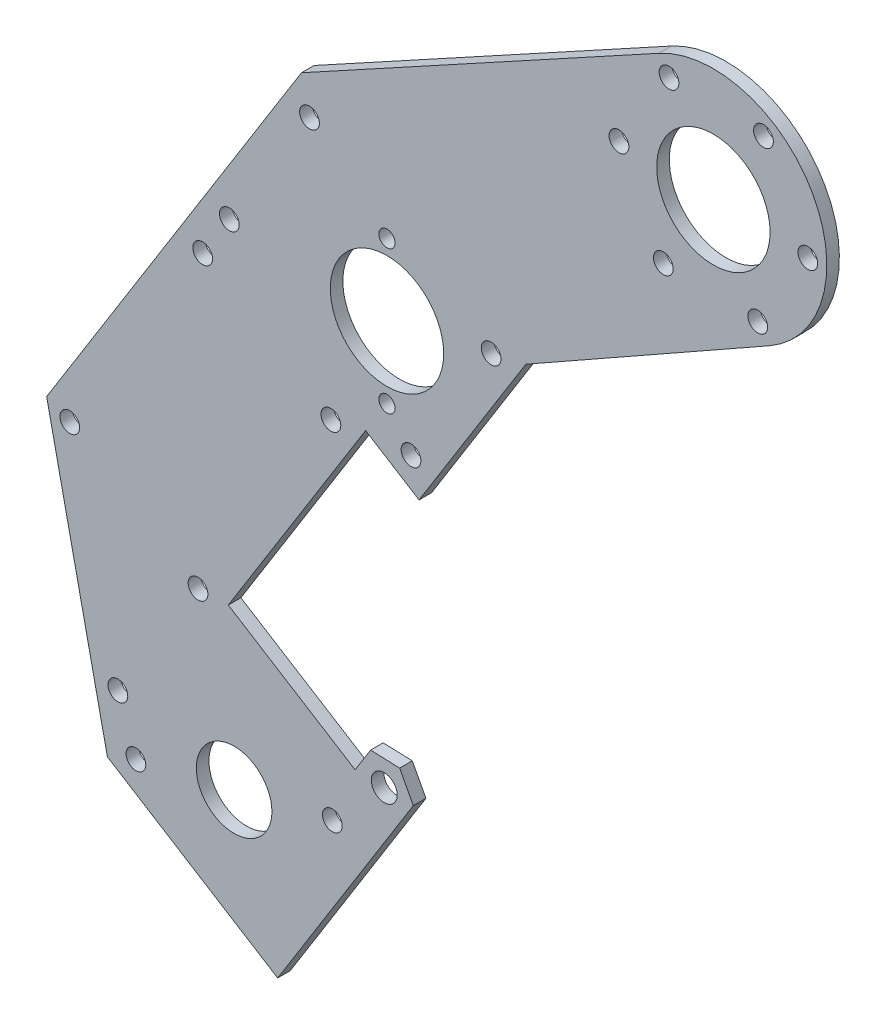
from build123d import *

# Parameters (mm, degrees)
SKETCH1_R                   = 14.2875
SKETCH1_R_2                 = 9.525
BOSS_EXTRUDE1_DEPTH         = 3.175
F_10_CLEARANCE_HOLE2_D      = 4.9784
F_10_CLEARANCE_HOLE3_D      = 4.9784
F_1_4_CLEARANCE_HOLE1_D     = 6.5278
F_20_0_161_DIAMETER_HOLE1_D = 4.0894


with BuildPart() as part:
    # Sketch1 → Boss-Extrude1 (new body)
    with BuildSketch(Plane.XY.offset(-14.194599474)):
        with BuildLine():
            Line((-11.403602879, 461.040918113), (18.881283072, 509.506866808))
            Line((18.881283072, 509.506866808), (22.784668372, 515.753589084))
            Line((22.784668372, 515.753589084), (19.342339301, 522.227668471))
            Line((19.342339301, 522.227668471), (12.014457551, 522.48356374))
            Line((12.014457551, 522.48356374), (8.11107225, 516.236841464))
            Line((8.11107225, 516.236841464), (-23.846467356, 536.206128526))
            Line((-23.846467356, 536.206128526), (10.759214603, 591.586796266))
            Line((10.759214603, 591.586796266), (24.22197813, 583.174327946))
            Line((24.22197813, 583.174327946), (51.141876753, 626.255171231))
            Line((51.141876753, 626.255171231), (112.462044501, 660.93728694))
            ThreePointArc((112.462044501, 660.93728694), (123.365099157, 699.702028841), (84.677956887, 710.877306848))
            Line((84.677956887, 710.877306848), (-5.401730059, 661.587538174))
            Line((-5.401730059, 661.587538174), (-69.615486106, 558.824047132))
            Line((-69.615486106, 558.824047132), (-54.307899735, 487.850498283))
            Line((-54.307899735, 487.850498283), (-11.403602879, 461.040918113))
        make_face()
        with Locations((16.14150623, 618.174698631)):
            Circle(SKETCH1_R, mode=Mode.SUBTRACT)
        with Locations((-22.373657227, 496.622766323)):
            Circle(SKETCH1_R_2, mode=Mode.SUBTRACT)
        with Locations((98.394472266, 685.809641802)):
            Circle(SKETCH1_R, mode=Mode.SUBTRACT)
    extrude(amount=BOSS_EXTRUDE1_DEPTH)

    # #10 Clearance Hole2 (through all)
    with Locations(Plane.XY.offset(-11.019599474)):
        with Locations((2.375342418, 502.336523103), (-47.122656873, 490.909009542), (-3.381611976, 652.837445435), (42.391784014, 624.235053148), (22.201860047, 591.924420685), (-23.571535943, 620.526812972), (-31.474844299, 535.981130963), (-63.785476762, 556.17105493), (-51.664768266, 503.670498499), (2.009121865, 589.566678183), (-30.301510599, 609.756602151)):
            Hole(F_10_CLEARANCE_HOLE2_D / 2)

    # #10 Clearance Hole3 (through all)
    with Locations(Plane.XY.offset(-11.019599474)):
        with Locations((111.013174745, 706.003787092), (122.192466334, 684.978597537), (109.573763855, 664.784452247), (85.775769786, 665.615496512), (74.596478197, 686.640686067), (87.215180677, 706.834831357)):
            Hole(F_10_CLEARANCE_HOLE3_D / 2)

    # 1/4 Clearance Hole1 (through all)
    with Locations(Plane.XY.offset(-11.019599474)):
        with Locations((15.456786622, 516.009484354)):
            Hole(F_1_4_CLEARANCE_HOLE1_D / 2)

    # #20 (0.161) Diameter Hole1 (through all)
    with Locations(Plane(origin=(0, 0, -14.194599474), x_dir=(-1, 0, 0), z_dir=(0, 0, -1))):
        with Locations((-16.141506225, 636.208698631), (-16.141506234, 600.140698631)):
            Hole(F_20_0_161_DIAMETER_HOLE1_D / 2)


solid = part.part
